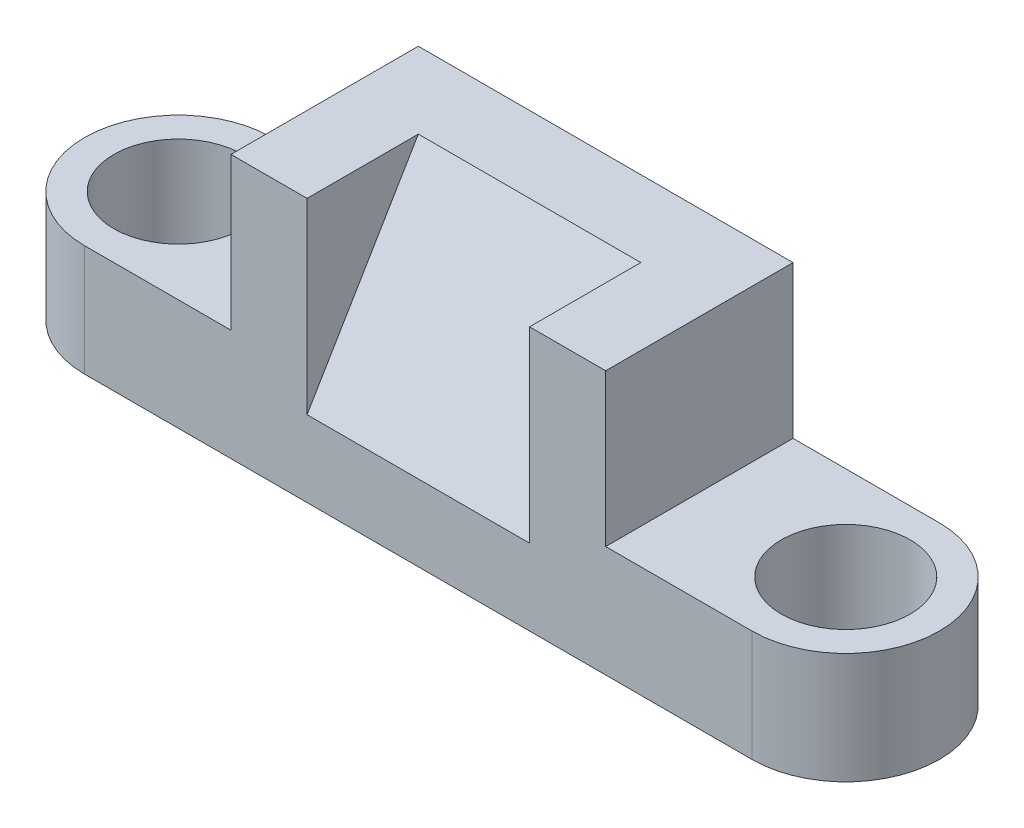
from build123d import *

# Parameters (mm, degrees)
SKETCH2_W           = 64
SKETCH2_H           = 64
BOSS_EXTRUDE1_DEPTH = 45
SKETCH3_R           = 11
BOSS_EXTRUDE2_DEPTH = 19
SKETCH7_W           = 16
SKETCH7_H           = 45
CUT_EXTRUDE2_DEPTH  = 148
SKETCH9_W           = 64
SKETCH9_H           = 16
CUT_EXTRUDE4_DEPTH  = 148
SKETCH10_W          = 38
SKETCH10_H          = 19
CUT_EXTRUDE5_DEPTH  = 32
BOSS_EXTRUDE4_DEPTH = 42


with BuildPart() as part:
    # Sketch2 → Boss-Extrude1 (new body)
    with BuildSketch(Plane(origin=(0, 0, 0), x_dir=(1, 0, 0), z_dir=(0, 1, 0))):
        with Locations((32, 32)):
            Rectangle(SKETCH2_W, SKETCH2_H)
    extrude(amount=BOSS_EXTRUDE1_DEPTH)

    # Sketch3 → Boss-Extrude2 (add)
    # profile 1 of 2: a face of its own
    with BuildSketch(Plane(origin=(0, 0, 0), x_dir=(1, 0, 0), z_dir=(0, 1, 0))):
        with BuildLine():
            Line((-25, 48), (0, 48))
            Line((0, 48), (0, 16))
            Line((0, 16), (-25, 16))
            ThreePointArc((-25, 16), (-41, 32), (-25, 48))
        make_face()
        with Locations(Location((-25, 32, 0), (0, 0, 270))):
            Circle(SKETCH3_R, mode=Mode.SUBTRACT)
    # profile 2 of 2: a face of its own
    with BuildSketch(Plane(origin=(0, 0, 0), x_dir=(1, 0, 0), z_dir=(0, 1, 0))):
        with BuildLine():
            Line((89, 48), (64, 48))
            Line((64, 48), (64, 16))
            Line((64, 16), (89, 16))
            ThreePointArc((89, 16), (105, 32), (89, 48))
        make_face()
        with Locations(Location((89, 32, 0), (0, 0, 270))):
            Circle(SKETCH3_R, mode=Mode.SUBTRACT)
    extrude(amount=BOSS_EXTRUDE2_DEPTH)

    # Sketch7 → Cut-Extrude2 (cut)
    with BuildSketch(Plane.ZY):
        with Locations((-8, 22.5)):
            Rectangle(SKETCH7_W, SKETCH7_H)
    extrude(amount=-CUT_EXTRUDE2_DEPTH, mode=Mode.SUBTRACT)

    # Sketch9 → Cut-Extrude4 (cut)
    with BuildSketch(Plane(origin=(0, 45, 0), x_dir=(1, 0, 0), z_dir=(0, 1, 0))):
        with Locations((32, 56)):
            Rectangle(SKETCH9_W, SKETCH9_H)
    extrude(amount=-CUT_EXTRUDE4_DEPTH, mode=Mode.SUBTRACT)

    # Sketch10 → Cut-Extrude5 (cut)
    with BuildSketch(Plane(origin=(0, 45, 0), x_dir=(1, 0, 0), z_dir=(0, 1, 0))):
        with Locations((32, 25.5)):
            Rectangle(SKETCH10_W, SKETCH10_H)
    extrude(amount=-CUT_EXTRUDE5_DEPTH, mode=Mode.SUBTRACT)

    # Sketch12 → Boss-Extrude4 (add)
    with BuildSketch(Plane.ZY.offset(-51)):
        Polygon((-35, 45), (-16, 13), (-35, 13), align=None)
    extrude(amount=BOSS_EXTRUDE4_DEPTH)


solid = part.part
